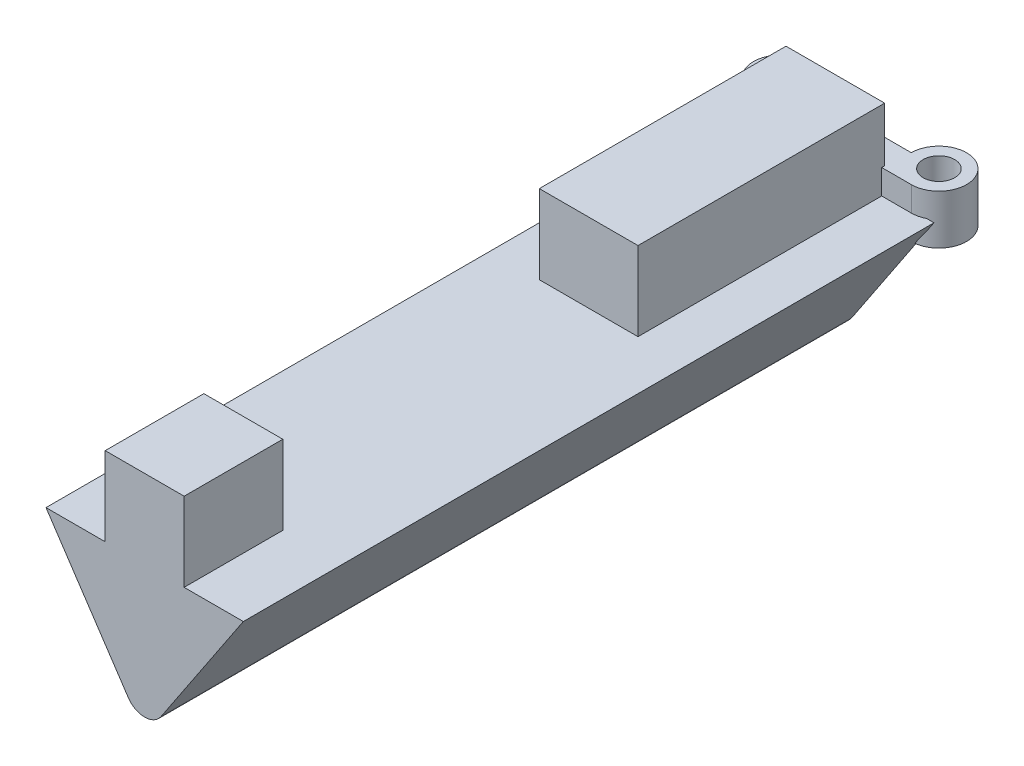
from build123d import *

# Parameters (mm, degrees)
EXTRUDE_1_DEPTH = 70
SKETCH_2_W      = 10
SKETCH_2_H      = 8
EXTRUDE_2_DEPTH = 25
SKETCH_3_W      = 8
SKETCH_3_H      = 8
EXTRUDE_3_DEPTH = 10
SKETCH_5_R      = 1.6
EXTRUDE_4_DEPTH = 2.5
FILLET_1_R      = 2


with BuildPart() as part:
    # 草图1 → 凸台-拉伸1 (new body)
    with BuildSketch(Plane.XY):
        Polygon((0, -15), (10, 0), (-10, 0), align=None)
    extrude(amount=EXTRUDE_1_DEPTH)

    # 草图2 → 凸台-拉伸2 (add)
    with BuildSketch(Plane.XY):
        with Locations((0, 4)):
            Rectangle(SKETCH_2_W, SKETCH_2_H)
    extrude(amount=EXTRUDE_2_DEPTH)

    # 草图3 → 凸台-拉伸3 (add)
    with BuildSketch(Plane.XY.offset(70)):
        with Locations((0, 4)):
            Rectangle(SKETCH_3_W, SKETCH_3_H)
    extrude(amount=-EXTRUDE_3_DEPTH)

    # 草图5 → 凸台-拉伸4 (add, symmetric)
    with BuildSketch(Plane.XZ):
        with BuildLine():
            Line((-5.2, -2.5), (5.2, -2.5))
            ThreePointArc((5.2, -2.5), (9.979898987, -4.479898987), (8, 0.3))
            Line((8, 0.3), (-8, 0.3))
            ThreePointArc((-8, 0.3), (-9.979898987, -4.479898987), (-5.2, -2.5))
        make_face()
        with Locations((-8, -2.5)):
            Circle(SKETCH_5_R, mode=Mode.SUBTRACT)
        with Locations(Location((8, -2.5, 0), (0, 0, 180))):
            Circle(SKETCH_5_R, mode=Mode.SUBTRACT)
    extrude(amount=EXTRUDE_4_DEPTH, both=True)

    # 圆角1
    fillet_1_edges = [part.edges().sort_by_distance(p)[0] for p in [
        (0, -15, 35),
    ]]
    fillet(fillet_1_edges, radius=FILLET_1_R)


solid = part.part
